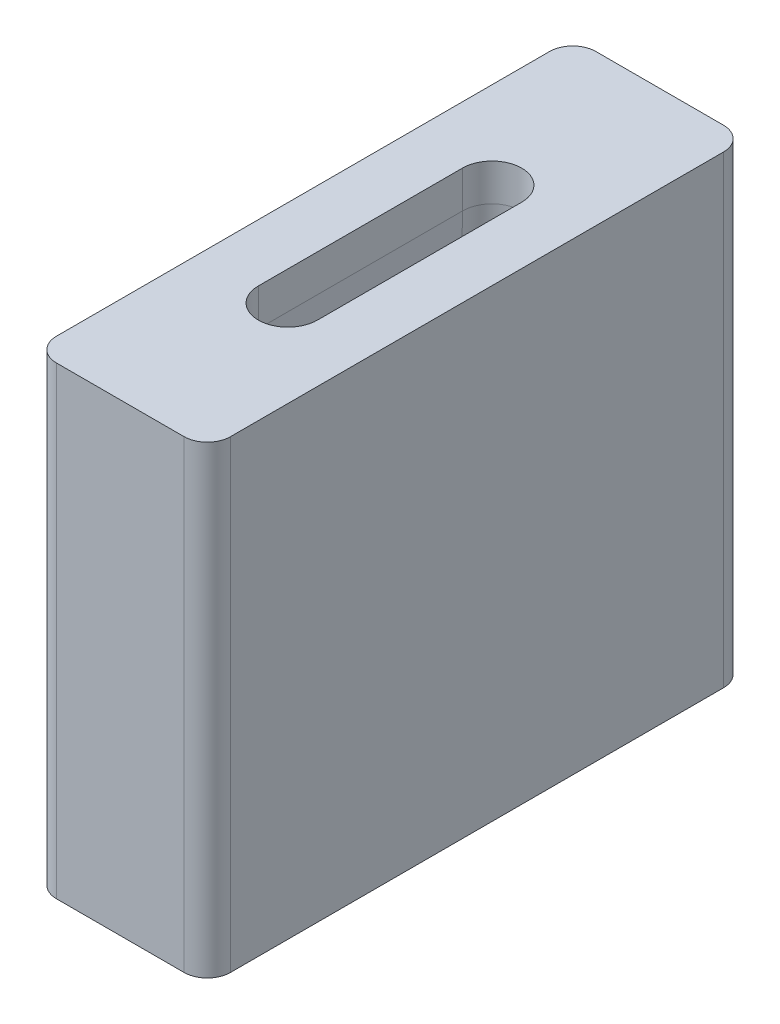
from build123d import *

# Parameters (mm, degrees)
BOSS_EXTRUDE1_DEPTH         = 40
CUT_EXTRUDE2_REACH          = 48.87
M6_TAPPED_HOLE1_D           = 5
M6_TAPPED_HOLE1_DEPTH       = 17
M6_TAPPED_HOLE1_CSINK_D     = 6.05
M6_TAPPED_HOLE1_CSINK_ANGLE = 90
M6_TAPPED_HOLE1_TIP         = 1.502151548


with BuildPart() as part:
    # Sketch1 → Boss-Extrude1 (new body)
    with BuildSketch(Plane(origin=(0, 0, 0), x_dir=(1, 0, 0), z_dir=(0, 1, 0))):
        with BuildLine():
            Line((-5.5, -23.25), (5.5, -23.25))
            ThreePointArc((5.5, -23.25), (6.914213562, -22.664213562), (7.5, -21.25))
            Line((7.5, -21.25), (7.5, 21.25))
            ThreePointArc((7.5, 21.25), (6.914213562, 22.664213562), (5.5, 23.25))
            Line((5.5, 23.25), (-5.5, 23.25))
            ThreePointArc((-5.5, 23.25), (-6.914213562, 22.664213562), (-7.5, 21.25))
            Line((-7.5, 21.25), (-7.5, -21.25))
            ThreePointArc((-7.5, -21.25), (-6.914213562, -22.664213562), (-5.5, -23.25))
        make_face()
    extrude(amount=-BOSS_EXTRUDE1_DEPTH)

    # Sketch5 → Cut-Extrude2 (cut, up to next)
    with BuildSketch(Plane(origin=(0, 0, 0), x_dir=(1, 0, 0), z_dir=(0, 1, 0)), mode=Mode.PRIVATE) as cut_extrude2_sk1:
        with BuildLine():
            Line((-2.55, -8.8), (-2.55, 8.8))
            ThreePointArc((-2.55, 8.8), (0, 11.35), (2.55, 8.8))
            Line((2.55, 8.8), (2.55, -8.8))
            ThreePointArc((2.55, -8.8), (0, -11.35), (-2.55, -8.8))
        make_face()
    cut_extrude2_tool1 = extrude(cut_extrude2_sk1.sketch, amount=-CUT_EXTRUDE2_REACH, mode=Mode.PRIVATE) & part.part
    add(cut_extrude2_tool1.solids().sort_by_distance((0, 0, 0))[0], mode=Mode.SUBTRACT)

    # Cut-Sweep1: sweep along a path in Sketch8
    with BuildLine(Plane(origin=(0, 0, 0), x_dir=(1, 0, 0), z_dir=(0, 1, 0))) as cut_sweep1_path:
        Line((-2.55, 8.8), (-2.55, -8.8))
        ThreePointArc((-2.55, -8.8), (0, -11.35), (2.55, -8.8))
        Line((2.55, -8.8), (2.55, 8.8))
        ThreePointArc((2.55, 8.8), (0, 11.35), (-2.55, 8.8))
    # Sketch7 → Cut-Sweep1 (sweep, cut)
    with BuildSketch(Plane.XY):
        Polygon((2.55, -3.2), (3.192346389, -40), (2.55, -40), align=None)
    sweep(path=cut_sweep1_path.line, mode=Mode.SUBTRACT)

    # M6 Tapped Hole1
    with Locations(Plane(origin=(0, -40, 0), x_dir=(-1, 0, 0), z_dir=(0, -1, 0))):
        with Locations((0, 19.25), (0, -19.25)):
            CounterSinkHole(M6_TAPPED_HOLE1_D / 2, M6_TAPPED_HOLE1_CSINK_D / 2, depth=M6_TAPPED_HOLE1_DEPTH, counter_sink_angle=M6_TAPPED_HOLE1_CSINK_ANGLE)
            with Locations((0, 0, -(M6_TAPPED_HOLE1_DEPTH + M6_TAPPED_HOLE1_TIP / 2))):  # 118° drill point
                Cone(0, M6_TAPPED_HOLE1_D / 2, M6_TAPPED_HOLE1_TIP, mode=Mode.SUBTRACT)


solid = part.part
